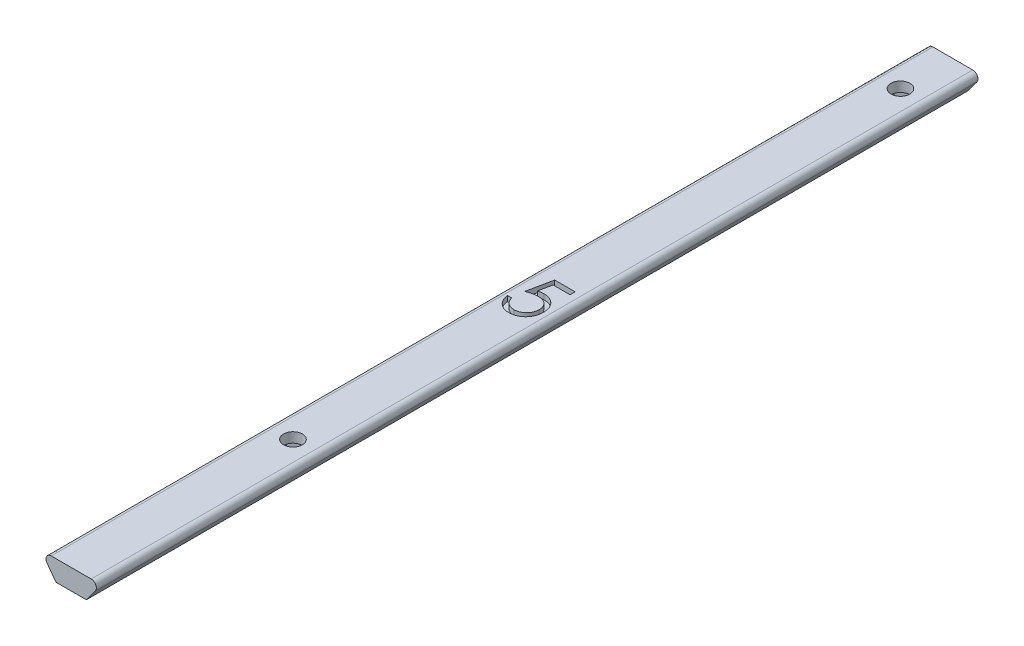
from build123d import *

# Parameters (mm, degrees)
BOSS_EXTRUDE1_DEPTH = 168.35
FILLET1_R           = 1
SKETCH2_R           = 1.8
CUT_EXTRUDE1_DEPTH  = 200
CUT_EXTRUDE2_DEPTH  = 2
LPATTERN1_COUNT     = 3
LPATTERN1_PITCH     = 116
CUT_EXTRUDE3_DEPTH  = 1


with BuildPart() as part:
    # Sketch1 → Boss-Extrude1 (new body)
    with BuildSketch(Plane.XY):
        Polygon((0, 0), (5.8, 0), (8.7, 3.9), (-2.9, 3.9), align=None)
    extrude(amount=BOSS_EXTRUDE1_DEPTH)

    # Fillet1
    fillet1_edges = [part.edges().sort_by_distance(p)[0] for p in [
        (-2.9, 3.9, 84.175),
        (8.7, 3.9, 84.175),
    ]]
    fillet(fillet1_edges, radius=FILLET1_R)

    # Sketch2 → Cut-Extrude1 (cut)
    with BuildSketch(Plane.XZ):
        with Locations(Location((2.9, 126, 0), (0, 0, 270))):
            Circle(SKETCH2_R)
    cut_extrude1 = extrude(amount=-CUT_EXTRUDE1_DEPTH, mode=Mode.SUBTRACT)

    # Sketch3 → Cut-Extrude2 (cut)
    with BuildSketch(Plane.XZ):
        Polygon((2.902268292, 122.651369207), (5.80113348, 124.327649002), (5.798865189, 127.676279795), (2.897731708, 129.348630793), (-0.00113348, 127.672350998), (0.001134811, 124.323720205), align=None)
    cut_extrude2 = extrude(amount=-CUT_EXTRUDE2_DEPTH, mode=Mode.SUBTRACT)

    # LPattern1: Cut-Extrude1, Cut-Extrude2 ×3
    with Locations(*[(0, 0, -i * LPATTERN1_PITCH) for i in range(1, LPATTERN1_COUNT)]):
        add(cut_extrude1, mode=Mode.SUBTRACT)
        add(cut_extrude2, mode=Mode.SUBTRACT)

    # Sketch4 → Cut-Extrude3 (cut)
    with BuildSketch(Plane(origin=(0, 3.9, 0), x_dir=(1, 0, 0), z_dir=(0, 1, 0))):
        with BuildLine():
            Line((5.439754142, -74.65), (5.439754142, -75.626923077))
            Line((5.439754142, -75.626923077), (2.199880343, -75.626923077))
            Line((2.199880343, -75.626923077), (1.686614118, -78.132196514))
            add(Edge.make_bspline(
                [(1.686614118, -78.132196514), (1.787459033, -78.10435556), (1.982830106, -78.050418115), (2.271192299, -77.990530983), (2.544946796, -77.954430025), (2.722589054, -77.949500672), (2.808549214, -77.947115385)],
                knots=[0, 0, 0, 0, 1.100273476, 2.13160584, 3.095893838, 4, 4, 4, 4], degree=3))
            add(Edge.make_bspline(
                [(2.808549214, -77.947115385), (2.91491282, -77.949417538), (3.124050244, -77.953944147), (3.430044807, -77.997410395), (3.722143609, -78.065826877), (3.999735773, -78.161404868), (4.263334843, -78.283623499), (4.510515564, -78.43629548), (4.74498817, -78.614639759), (4.96254623, -78.819685828), (5.159915954, -79.045351085), (5.33345054, -79.287987862), (5.480850161, -79.545238143), (5.599397644, -79.819559799), (5.694060725, -80.107920067), (5.757067225, -80.413353024), (5.799022697, -80.732979693), (5.803710049, -80.951522845), (5.806100295, -81.062965745)],
                knots=[0, 0, 0, 0, 1.052922333, 2.070308379, 3.05430497, 4.020497103, 4.973039431, 5.925935799, 6.892292201, 7.88610001, 8.88166317, 9.857072816, 10.836096531, 11.812156883, 12.81219415, 13.836441305, 14.89672472, 16, 16, 16, 16], degree=3))
            add(Edge.make_bspline(
                [(5.806100295, -81.062965745), (5.804290341, -81.140586931), (5.800694891, -81.294780318), (5.782410734, -81.52377275), (5.747207107, -81.747917317), (5.699942087, -81.967243755), (5.638594506, -82.181336832), (5.564329295, -82.390809347), (5.473444392, -82.594357527), (5.373754721, -82.793907352), (5.261505377, -82.984947575), (5.136922439, -83.163606603), (5.005299209, -83.332564541), (4.863672296, -83.490009343), (4.710725302, -83.634906413), (4.548310535, -83.768115664), (4.377723993, -83.891889856), (4.196326512, -84.00120473), (4.008160183, -84.101796775), (3.810507678, -84.184320116), (3.6078682, -84.258099482), (3.397325217, -84.316908268), (3.179355627, -84.362989005), (2.953600131, -84.394287068), (2.721242736, -84.417082945), (2.563740024, -84.418509945), (2.484180223, -84.419230769)],
                knots=[0, 0, 0, 0, 1.056347294, 2.098418968, 3.122841568, 4.141288669, 5.149314143, 6.15115421, 7.162517403, 8.180376062, 9.185164535, 10.17417709, 11.141909838, 12.097768115, 13.052685741, 14.0056014, 14.954263652, 15.917497458, 16.885230207, 17.854509472, 18.828990115, 19.81800267, 20.826176721, 21.857883937, 22.917946725, 24, 24, 24, 24], degree=3))
            add(Edge.make_bspline(
                [(2.484180223, -84.419230769), (2.389272632, -84.417350703), (2.202553157, -84.413651895), (1.928993613, -84.374957303), (1.665791722, -84.319538359), (1.415066233, -84.236163939), (1.174570151, -84.131695658), (0.947541183, -83.999662363), (0.728178321, -83.850040659), (0.525399135, -83.673473413), (0.337195712, -83.48048145), (0.16872157, -83.271046726), (0.018679479, -83.048625887), (-0.110527818, -82.812138768), (-0.22074029, -82.562206766), (-0.307322508, -82.297893456), (-0.377204317, -82.020579874), (-0.40676834, -81.829662107), (-0.42178432, -81.732692308)],
                knots=[0, 0, 0, 0, 1.0467383, 2.05933395, 3.04377827, 4.011590433, 4.970194871, 5.932262533, 6.905835911, 7.896367577, 8.894135286, 9.877477877, 10.858688626, 11.851381753, 12.8477658, 13.868841284, 14.917554742, 16, 16, 16, 16], degree=3))
            Line((-0.42178432, -81.732692308), (0.433023372, -81.732692308))
            add(Edge.make_bspline(
                [(0.433023372, -81.732692308), (0.454056089, -81.823523939), (0.494482139, -81.998107378), (0.583216355, -82.243393385), (0.691708488, -82.461976416), (0.820716036, -82.656747924), (0.974612905, -82.826589553), (1.150225136, -82.977947414), (1.347114297, -83.114495445), (1.565898729, -83.228313118), (1.796711466, -83.325383083), (2.038285088, -83.390021624), (2.284041916, -83.435471911), (2.450262338, -83.440021489), (2.533789598, -83.442307692)],
                knots=[0, 0, 0, 0, 1.136247022, 2.183929868, 3.172523383, 4.106158343, 5.02341133, 5.958108904, 6.928429099, 7.938127109, 8.96079061, 9.975095812, 10.982467395, 12, 12, 12, 12], degree=3))
            add(Edge.make_bspline(
                [(2.533789598, -83.442307692), (2.615319365, -83.440074004), (2.775852142, -83.435675853), (3.01210313, -83.40182397), (3.240193881, -83.349688008), (3.457873759, -83.271665046), (3.668951949, -83.176837633), (3.868089138, -83.055148749), (4.061046254, -82.915103984), (4.241825675, -82.754657727), (4.40739589, -82.577847343), (4.553689334, -82.38876958), (4.675546506, -82.187065876), (4.778237188, -81.976228224), (4.856215094, -81.753945865), (4.911843764, -81.521260524), (4.944509231, -81.277597471), (4.9490028, -81.111401706), (4.951292603, -81.02671274)],
                knots=[0, 0, 0, 0, 1.027316725, 2.022795036, 3.002884548, 3.971462791, 4.93288096, 5.914575861, 6.907176829, 7.935150275, 8.956128384, 9.956726525, 10.942570165, 11.921478529, 12.907843606, 13.90538589, 14.932640048, 16, 16, 16, 16], degree=3))
            add(Edge.make_bspline(
                [(4.951292603, -81.02671274), (4.949500598, -80.950306588), (4.945993004, -80.800752415), (4.917334809, -80.581951718), (4.867486477, -80.374924367), (4.798297204, -80.17867063), (4.710450829, -79.993005405), (4.603100508, -79.817737077), (4.474231618, -79.655175717), (4.327024407, -79.505245267), (4.165757881, -79.366874572), (3.98765741, -79.248916737), (3.796450038, -79.149682789), (3.594439485, -79.064044879), (3.376820725, -79.002538565), (3.147903318, -78.956361677), (2.905215278, -78.929649869), (2.739287905, -78.925943587), (2.65399693, -78.924038462)],
                knots=[0, 0, 0, 0, 1.045622112, 2.046656509, 3.013763289, 3.955457236, 4.890082067, 5.820317437, 6.762574623, 7.722996705, 8.69280354, 9.665887285, 10.63943826, 11.638615906, 12.663482002, 13.728887084, 14.832589034, 16, 16, 16, 16], degree=3))
            add(Edge.make_bspline(
                [(2.65399693, -78.924038462), (2.580167488, -78.925618499), (2.427728421, -78.928880875), (2.193895585, -78.952901556), (1.948173111, -78.991652779), (1.691502948, -79.044955352), (1.423114279, -79.114708497), (1.143573489, -79.198295816), (0.85229282, -79.298232113), (0.656029585, -79.373703352), (0.555138757, -79.4125)],
                knots=[0, 0, 0, 0, 0.817624296, 1.688186739, 2.600797293, 3.572016777, 4.590301741, 5.671205678, 6.80286297, 8, 8, 8, 8], degree=3))
            Line((0.555138757, -79.4125), (1.532061834, -74.65))
            Line((1.532061834, -74.65), (5.439754142, -74.65))
        make_face()
    extrude(amount=-CUT_EXTRUDE3_DEPTH, mode=Mode.SUBTRACT)


solid = part.part
